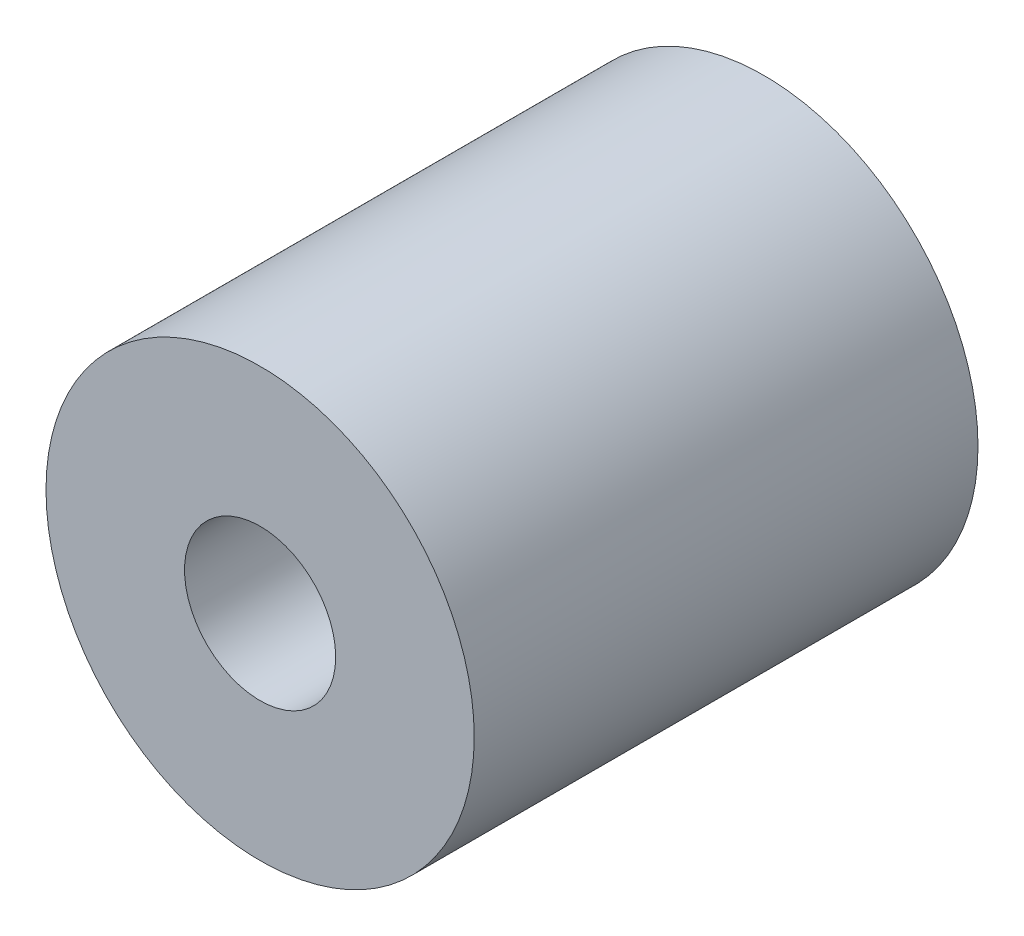
from build123d import *

# Parameters (mm, degrees)
SKETCH1_R           = 8.5
BOSS_EXTRUDE1_DEPTH = 20
SKETCH2_R           = 3
CUT_EXTRUDE1_DEPTH  = 24.334523779


with BuildPart() as part:
    # Sketch1 → Boss-Extrude1 (new body)
    with BuildSketch(Plane.XY):
        Circle(SKETCH1_R)
    extrude(amount=BOSS_EXTRUDE1_DEPTH)

    # Sketch2 → Cut-Extrude1 (cut, through all)
    with BuildSketch(Plane.XY.offset(20)):
        Circle(SKETCH2_R)
    extrude(amount=-CUT_EXTRUDE1_DEPTH, mode=Mode.SUBTRACT)


solid = part.part
